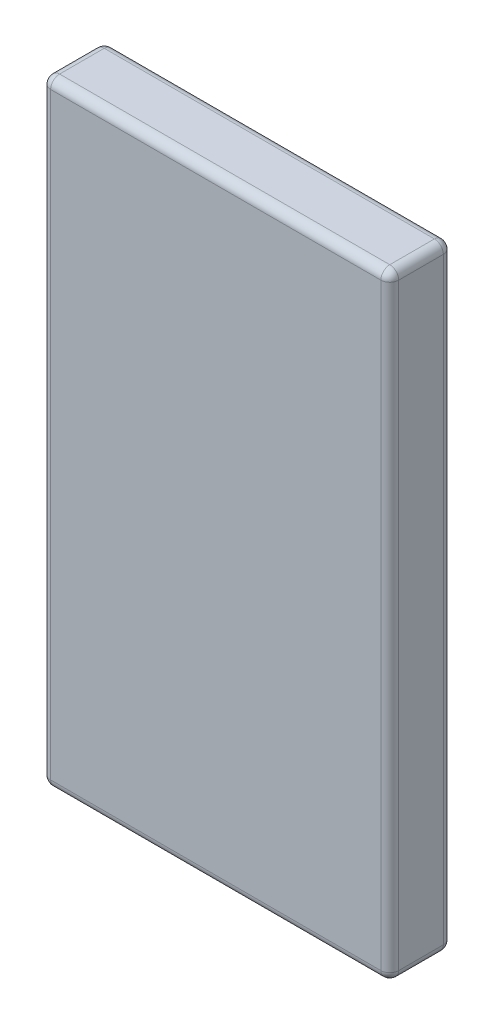
from build123d import *

# Parameters (mm, degrees)
SKETCH1_W           = 39
SKETCH1_H           = 69
BOSS_EXTRUDE1_DEPTH = 7
FILLET1_R           = 1


with BuildPart() as part:
    # Sketch1 → Boss-Extrude1 (new body)
    with BuildSketch(Plane.XY):
        with Locations((3.123947554, 21.27205749)):
            Rectangle(SKETCH1_W, SKETCH1_H)
    extrude(amount=BOSS_EXTRUDE1_DEPTH)

    # Fillet1
    fillet1_edges = [part.edges().sort_by_distance(p)[0] for p in [
        (22.623947554, 21.27205749, 7),
        (3.123947554, 55.77205749, 7),
        (-16.376052446, 21.27205749, 7),
        (3.123947554, 55.77205749, 0),
        (22.623947554, 21.27205749, 0),
        (3.123947554, -13.22794251, 0),
        (-16.376052446, 21.27205749, 0),
        (3.123947554, -13.22794251, 7),
        (-16.376052446, 55.77205749, 3.5),
        (22.623947554, 55.77205749, 3.5),
        (22.623947554, -13.22794251, 3.5),
        (-16.376052446, -13.22794251, 3.5),
    ]]
    fillet(fillet1_edges, radius=FILLET1_R)


solid = part.part
